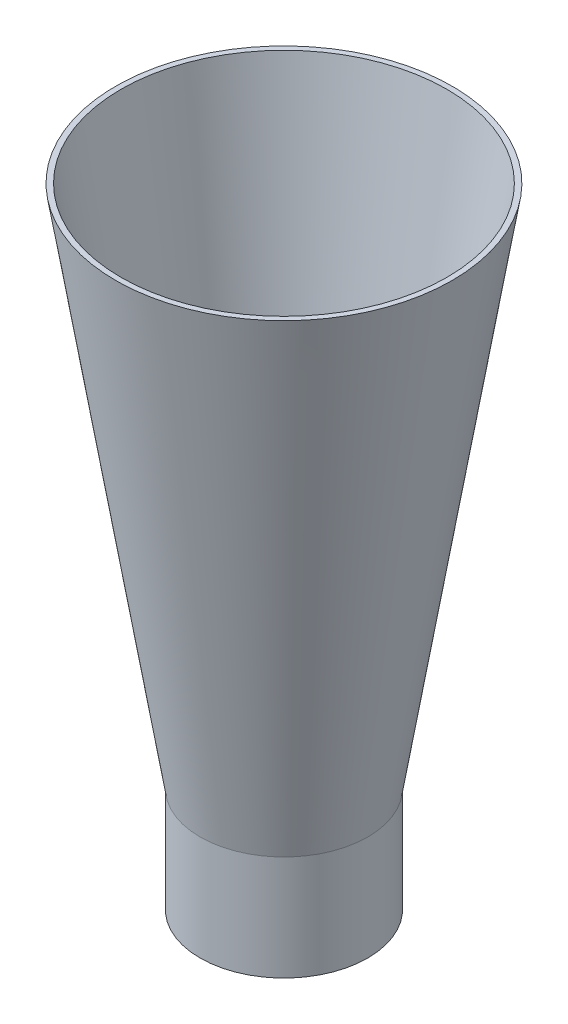
from build123d import *

# Parameters (mm, degrees)
SHELL_1_T = -1


with BuildPart() as part:
    # 스케치1 → 회전1 (revolve)
    with BuildSketch(Plane.XY):
        Polygon((0, 0), (32.1, 0), (16, -100), (16, -120), (0, -120), align=None)
    revolve(axis=Axis((0, -120, 0), (0, 1, 0)))

    # 쉘1
    shell_1_openings = [part.faces().sort_by_distance(p)[0] for p in [
        (0, -120, 0),
        (0, 0, 0),
    ]]
    offset(amount=SHELL_1_T, openings=shell_1_openings, kind=Kind.INTERSECTION)


solid = part.part
